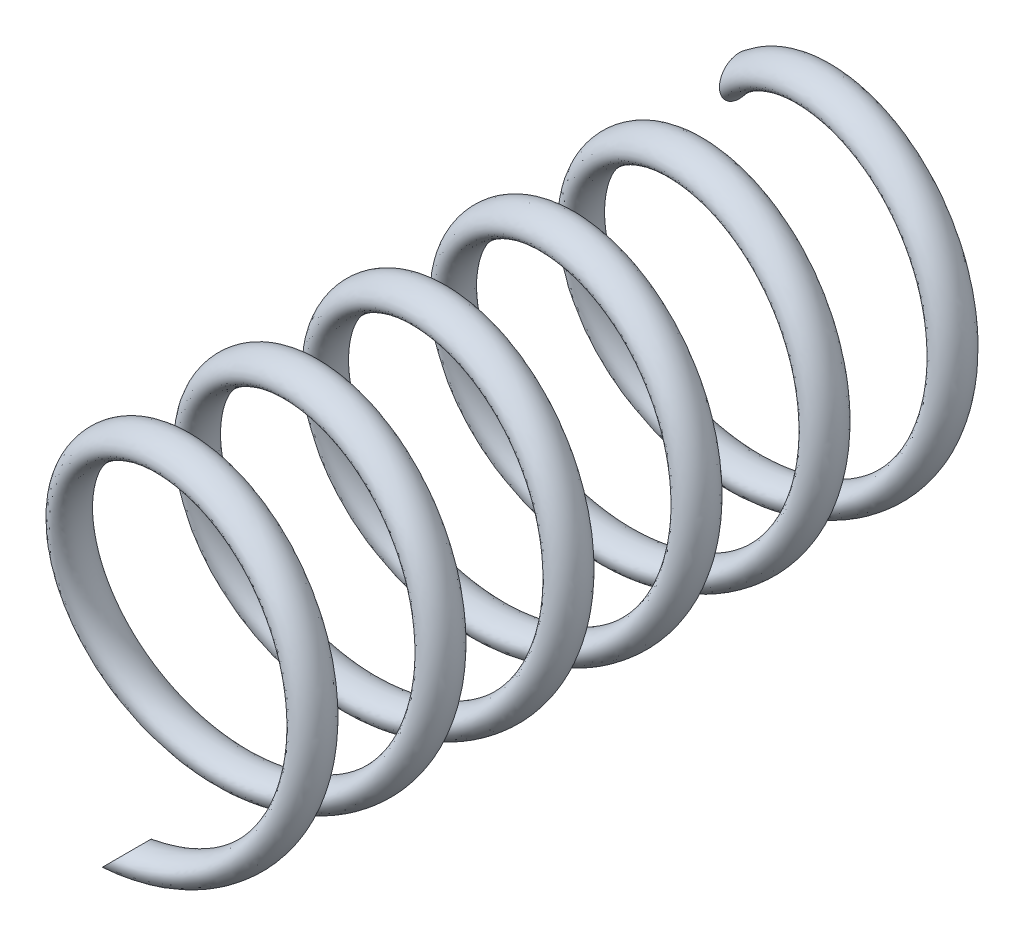
from build123d import *

# Parameters (mm, degrees)
SWEEP1_PITCH       = 8
SWEEP1_HEIGHT      = 45
SWEEP1_RADIUS      = 9.5
SWEEP1_START_ANGLE = 135
SKETCH5_R          = 1.25


with BuildPart() as part:
    # Sweep1: sweep along a helix
    with BuildLine() as sweep1_path:
        add(Helix(SWEEP1_PITCH, SWEEP1_HEIGHT, SWEEP1_RADIUS, center=(0, 0, 0), direction=(0, 0, 1), lefthand=True, mode=Mode.PRIVATE).rotate(Axis((0, 0, 0), (0, 0, 1)), SWEEP1_START_ANGLE))
    # Sketch5 → Sweep1 (sweep)
    with BuildSketch(Plane(origin=(-6.717514421, 0, 0), x_dir=(0, 0, -1), z_dir=(1, 0, 0))):
        with Locations((0, 6.717514421)):
            Circle(SKETCH5_R)
    sweep(path=sweep1_path.line, is_frenet=True)


solid = part.part
